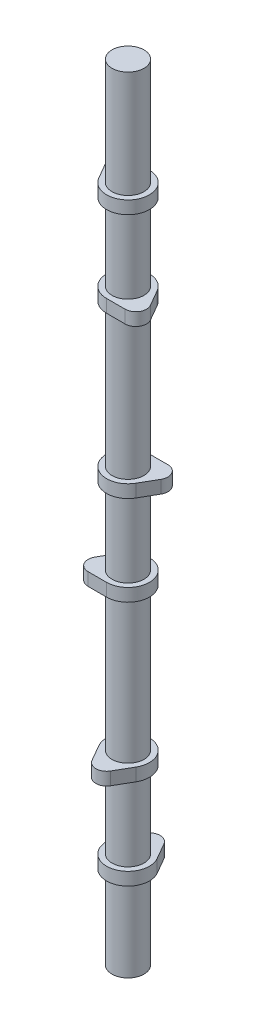
from build123d import *

# Parameters (mm, degrees)
BOSS_EXTRUDE1_DEPTH   = 7.62
LPATTERN1_COUNT       = 2
LPATTERN1_PITCH       = 53.34
BODY_MOVE_COPY2_ANGLE = 180
LPATTERN2_COUNT       = 3
LPATTERN2_PITCH       = 146.05
BODY_MOVE_COPY3_ANGLE = 120
BODY_MOVE_COPY4_ANGLE = 120
BOSS_EXTRUDE2_START   = -49.53
SKETCH3_R             = 9.5
BOSS_EXTRUDE2_DEPTH   = 466.09


with BuildPart() as part:
    # Sketch1 → Boss-Extrude1 (new body)
    with BuildSketch(Plane(origin=(0, 0, 0), x_dir=(1, 0, 0), z_dir=(0, 1, 0))):
        with BuildLine():
            Line((-5.499261314, 15.875), (-10.998522628, 6.35))
            ThreePointArc((-10.998522628, 6.35), (0, -12.7), (10.998522628, 6.35))
            Line((10.998522628, 6.35), (5.499261314, 15.875))
            ThreePointArc((5.499261314, 15.875), (0, 19.05), (-5.499261314, 15.875))
        make_face()
    extrude(amount=BOSS_EXTRUDE1_DEPTH)


with BuildPart() as lpattern1_1:
    # LPattern1: pattern copy
    add(part.part.moved(Location(Vector(0, 1, 0) * (1 * LPATTERN1_PITCH))))


with BuildPart() as lpattern1_1_1:
    # Body-Move/Copy2: moved
    add(lpattern1_1.part.rotate(Axis((0, 0, 0), (0, 1, 0)), BODY_MOVE_COPY2_ANGLE))


with BuildPart() as lpattern2_1:
    # LPattern2: pattern copy
    add(part.part.moved(Location(Vector(0, 1, 0) * (1 * LPATTERN2_PITCH))))


with BuildPart() as lpattern2_2:
    # LPattern2: pattern copy
    add(part.part.moved(Location(Vector(0, 1, 0) * (2 * LPATTERN2_PITCH))))


with BuildPart() as lpattern2_3:
    # LPattern2: pattern copy
    add(lpattern1_1_1.part.moved(Location(Vector(0, 1, 0) * (1 * LPATTERN2_PITCH))))


with BuildPart() as lpattern2_4:
    # LPattern2: pattern copy
    add(lpattern1_1_1.part.moved(Location(Vector(0, 1, 0) * (2 * LPATTERN2_PITCH))))


with BuildPart() as lpattern2_1_1:
    # Body-Move/Copy3: moved
    add(lpattern2_1.part.rotate(Axis((0, 0, 0), (0, 1, 0)), BODY_MOVE_COPY3_ANGLE))


with BuildPart() as lpattern2_3_1:
    # Body-Move/Copy3: moved
    add(lpattern2_3.part.rotate(Axis((0, 0, 0), (0, 1, 0)), BODY_MOVE_COPY3_ANGLE))


with BuildPart() as lpattern2_2_1:
    # Body-Move/Copy4: moved
    add(lpattern2_2.part.rotate(Axis((0, 0, 0), (0, -1, 0)), BODY_MOVE_COPY4_ANGLE))


with BuildPart() as lpattern2_4_1:
    # Body-Move/Copy4: moved
    add(lpattern2_4.part.rotate(Axis((0, 0, 0), (0, -1, 0)), BODY_MOVE_COPY4_ANGLE))


with BuildPart() as part_1:
    add(part.part)

    add(lpattern1_1_1.part)  # Boss-Extrude2 merges LPattern1_1

    add(lpattern2_1_1.part)  # Boss-Extrude2 merges LPattern2_1

    add(lpattern2_2_1.part)  # Boss-Extrude2 merges LPattern2_2

    add(lpattern2_3_1.part)  # Boss-Extrude2 merges LPattern2_3

    add(lpattern2_4_1.part)  # Boss-Extrude2 merges LPattern2_4
    # Sketch3 → Boss-Extrude2 (add)
    with BuildSketch(Plane(origin=(0, 0, 0), x_dir=(1, 0, 0), z_dir=(0, 1, 0)).offset(BOSS_EXTRUDE2_START)):
        Circle(SKETCH3_R)
    extrude(amount=BOSS_EXTRUDE2_DEPTH)


solid = part_1.part
